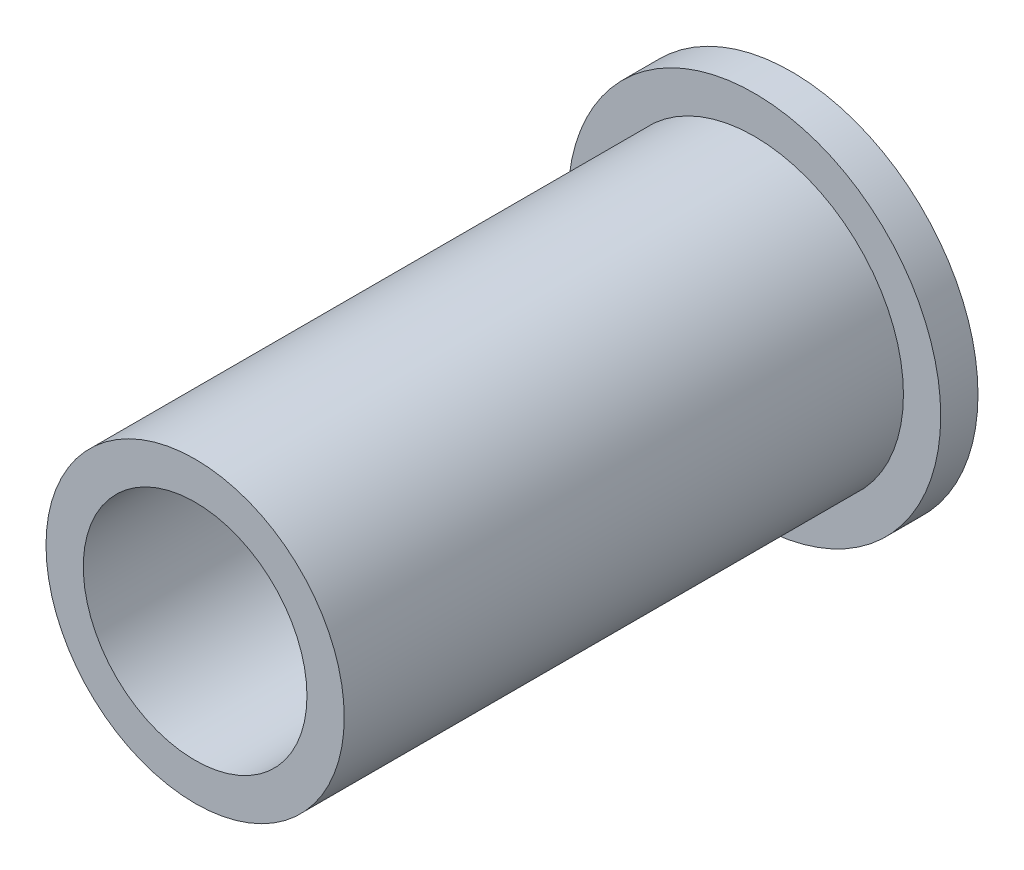
from build123d import *

# Parameters (mm, degrees)
SKETCH1_R           = 25
BOSS_EXTRUDE1_DEPTH = 5
SKETCH2_R           = 20
BOSS_EXTRUDE2_DEPTH = 75
SKETCH3_R           = 15
CUT_EXTRUDE1_DEPTH  = 70


with BuildPart() as part:
    # Sketch1 → Boss-Extrude1 (new body)
    with BuildSketch(Plane.XY):
        Circle(SKETCH1_R)
    extrude(amount=BOSS_EXTRUDE1_DEPTH)

    # Sketch2 → Boss-Extrude2 (add)
    with BuildSketch(Plane.XY.offset(5)):
        Circle(SKETCH2_R)
    extrude(amount=BOSS_EXTRUDE2_DEPTH)

    # Sketch3 → Cut-Extrude1 (cut)
    with BuildSketch(Plane.XY.offset(80)):
        Circle(SKETCH3_R)
    extrude(amount=-CUT_EXTRUDE1_DEPTH, mode=Mode.SUBTRACT)


solid = part.part
